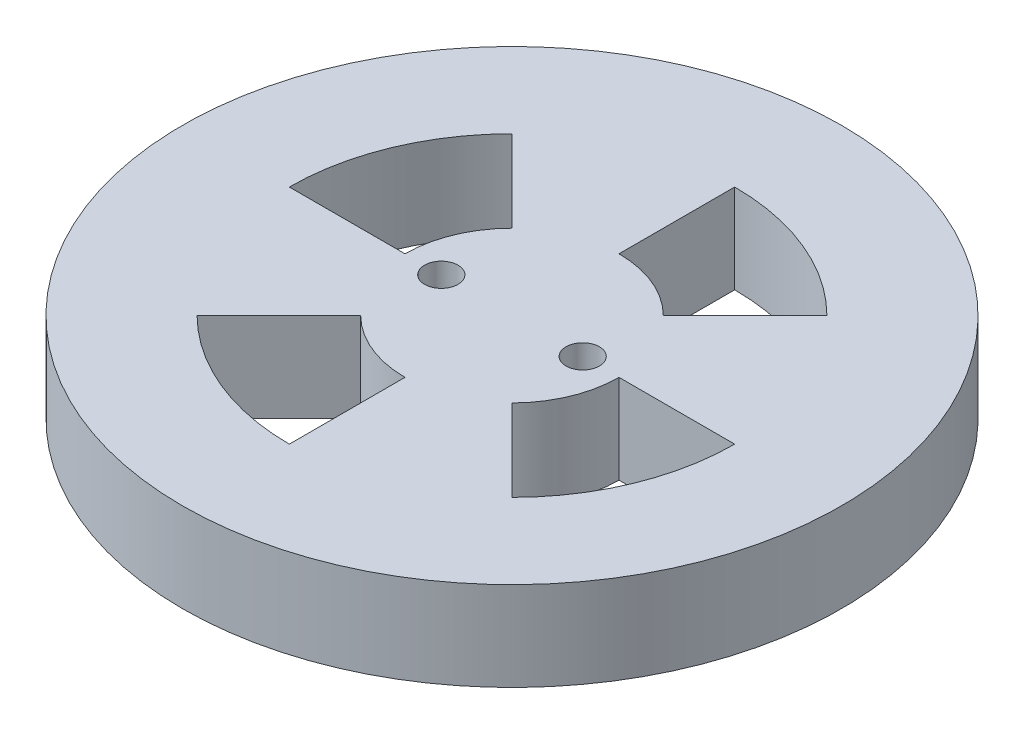
from build123d import *

# Parameters (mm, degrees)
ESBO_O1_R                = 29.6
RESSALTO_EXTRUS_O1_DEPTH = 8
CORTE_EXTRUS_O2_DEPTH    = 8
ESBO_O4_R                = 1.5
CORTE_EXTRUS_O4_DEPTH    = 8


with BuildPart() as part:
    # Esboço1 → Ressalto-extrusão1 (new body)
    with BuildSketch(Plane(origin=(0, 0, 0), x_dir=(1, 0, 0), z_dir=(0, 1, 0))):
        with Locations(Location((-36.441507633, 11.937959287, 0), (0, 0, 270))):
            Circle(ESBO_O1_R)
    extrude(amount=RESSALTO_EXTRUS_O1_DEPTH)

    # Esboço2 → Corte-extrusão2 (cut)
    with BuildSketch(Plane(origin=(0, 8, 0), x_dir=(1, 0, 0), z_dir=(0, 1, 0))):
        with BuildLine():
            ThreePointArc((-46.052507633, 11.937959287), (-45.32091382, 15.615929755), (-43.237510907, 18.733962561))
            Line((-43.237510907, 18.733962561), (-50.583643257, 26.080094911))
            ThreePointArc((-50.583643257, 26.080094911), (-54.919098283, 19.591627934), (-56.441507633, 11.937959287))
            Line((-56.441507633, 11.937959287), (-46.052507633, 11.937959287))
        make_face()
        with BuildLine():
            ThreePointArc((-36.441507633, 21.548959287), (-32.763537165, 20.817365474), (-29.645504359, 18.733962561))
            Line((-29.645504359, 18.733962561), (-22.299372009, 26.080094911))
            ThreePointArc((-22.299372009, 26.080094911), (-28.787838986, 30.415549937), (-36.441507633, 31.937959287))
            Line((-36.441507633, 31.937959287), (-36.441507633, 21.548959287))
        make_face()
        with BuildLine():
            Line((-16.441507633, 11.937959287), (-26.830507633, 11.937959287))
            ThreePointArc((-26.830507633, 11.937959287), (-27.562101446, 8.259988818), (-29.645504359, 5.141956013))
            Line((-29.645504359, 5.141956013), (-22.299372009, -2.204176337))
            ThreePointArc((-22.299372009, -2.204176337), (-17.963916983, 4.28429064), (-16.441507633, 11.937959287))
        make_face()
        with BuildLine():
            Line((-36.441507633, -8.062040713), (-36.441507633, 2.326959287))
            ThreePointArc((-36.441507633, 2.326959287), (-40.119478102, 3.0585531), (-43.237510907, 5.141956013))
            Line((-43.237510907, 5.141956013), (-50.583643257, -2.204176337))
            ThreePointArc((-50.583643257, -2.204176337), (-44.09517628, -6.539631363), (-36.441507633, -8.062040713))
        make_face()
    extrude(amount=-CORTE_EXTRUS_O2_DEPTH, mode=Mode.SUBTRACT)

    # Esboço4 → Corte-extrusão4 (cut)
    with BuildSketch(Plane(origin=(0, 8, 0), x_dir=(1, 0, 0), z_dir=(0, 1, 0))):
        with Locations(Location((-30.091507633, 11.937959287, 0), (0, 0, 270))):
            Circle(ESBO_O4_R)
        with Locations(Location((-42.791507633, 11.937959287, 0), (0, 0, 270))):
            Circle(ESBO_O4_R)
    extrude(amount=-CORTE_EXTRUS_O4_DEPTH, mode=Mode.SUBTRACT)


solid = part.part
